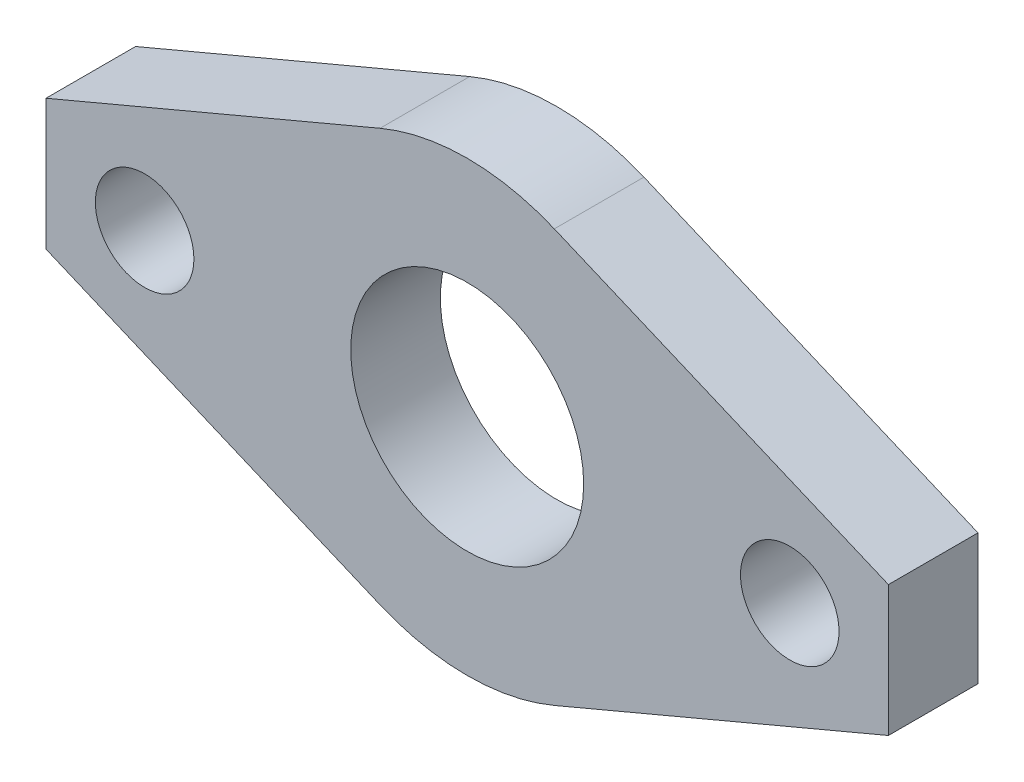
from build123d import *

# Parameters (mm, degrees)
SKETCH1_R           = 6.5
SKETCH1_R_2         = 2.75
BOSS_EXTRUDE1_DEPTH = 5


with BuildPart() as part:
    # Sketch1 → Boss-Extrude1 (new body)
    with BuildSketch(Plane.XY):
        with BuildLine():
            Line((-23.503678525, 19.646734505), (-23.503678525, 12.353265495))
            Line((-23.503678525, 12.353265495), (-4.861111111, 4.4839417))
            ThreePointArc((-4.861111111, 4.4839417), (0, 3.5), (4.861111111, 4.4839417))
            Line((4.861111111, 4.4839417), (23.503678525, 12.353265495))
            Line((23.503678525, 12.353265495), (23.503678525, 19.646734505))
            Line((23.503678525, 19.646734505), (4.861111111, 27.5160583))
            ThreePointArc((4.861111111, 27.5160583), (0, 28.5), (-4.861111111, 27.5160583))
            Line((-4.861111111, 27.5160583), (-23.503678525, 19.646734505))
        make_face()
        with Locations((0, 16)):
            Circle(SKETCH1_R, mode=Mode.SUBTRACT)
        with Locations((-18, 16)):
            Circle(SKETCH1_R_2, mode=Mode.SUBTRACT)
        with Locations((18, 16)):
            Circle(SKETCH1_R_2, mode=Mode.SUBTRACT)
    extrude(amount=BOSS_EXTRUDE1_DEPTH)


solid = part.part
